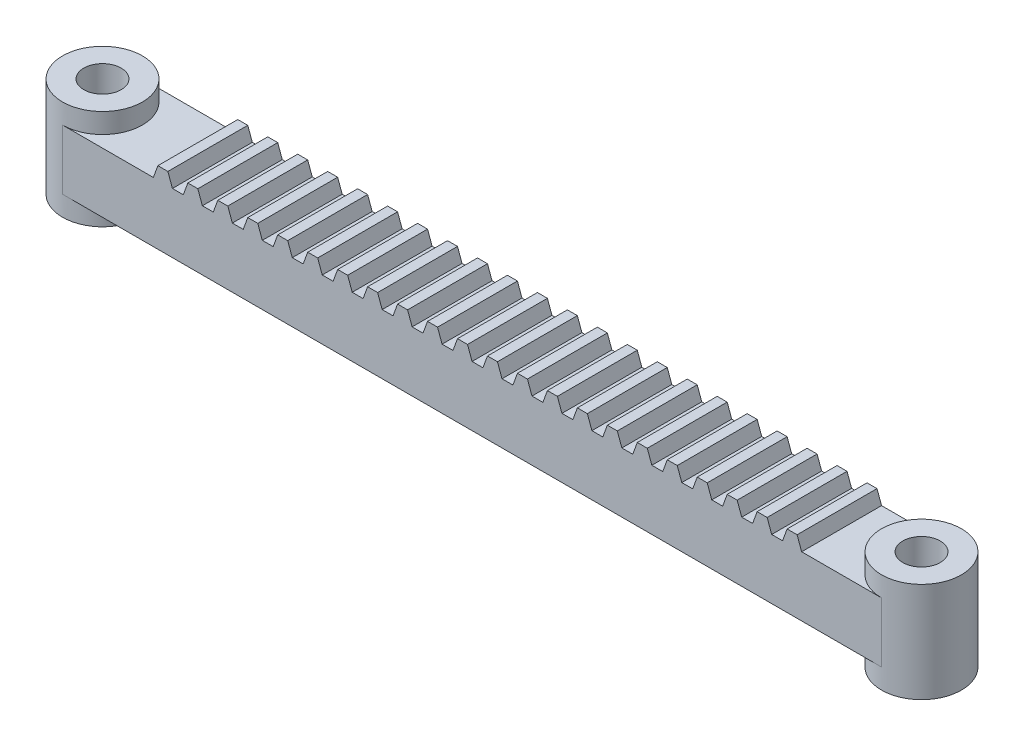
from build123d import *

# Parameters (mm, degrees)
BOSS_EXTRUDE1_DEPTH      = 8
BOSS_EXTRUDE1_DEPTH_BACK = 8
BOSS_EXTRUDE2_DEPTH      = 4
BOSS_EXTRUDE2_DEPTH_BACK = 16
SKETCH2_R                = 8
SKETCH2_R_2              = 3.75
SKETCH2_2_R              = 3.75
CUT_EXTRUDE1_DEPTH       = 16


with BuildPart() as part:
    # Sketch1 → Boss-Extrude1 (new, two sides: drawn at the far end of the back side and taken through both)
    with BuildSketch(Plane.XY.offset(-BOSS_EXTRUDE1_DEPTH_BACK)):
        Polygon((-82, 12), (-82, 0), (82, 0), (82, 12), (66, 12), (65.090074414, 14.5), (63.090074414, 14.5), (62.180148829, 12), (60, 12), (59.090074414, 14.5), (57.090074414, 14.5), (56.180148829, 12), (54, 12), (53.090074414, 14.5), (51.090074414, 14.5), (50.180148829, 12), (48, 12), (47.090074414, 14.5), (45.090074414, 14.5), (44.180148829, 12), (42, 12), (41.090074414, 14.5), (39.090074414, 14.5), (38.180148829, 12), (36, 12), (35.090074414, 14.5), (33.090074414, 14.5), (32.180148829, 12), (30, 12), (29.090074414, 14.5), (27.090074414, 14.5), (26.180148829, 12), (24, 12), (23.090074414, 14.5), (21.090074414, 14.5), (20.180148829, 12), (18, 12), (17.090074414, 14.5), (15.090074414, 14.5), (14.180148829, 12), (12, 12), (11.090074414, 14.5), (9.090074414, 14.5), (8.180148829, 12), (6, 12), (5.090074414, 14.5), (3.090074414, 14.5), (2.180148829, 12), (0, 12), (-0.909925586, 14.5), (-2.909925586, 14.5), (-3.819851171, 12), (-6, 12), (-6.909925586, 14.5), (-8.909925586, 14.5), (-9.819851171, 12), (-12, 12), (-12.909925586, 14.5), (-14.909925586, 14.5), (-15.819851171, 12), (-18, 12), (-18.909925586, 14.5), (-20.909925586, 14.5), (-21.819851171, 12), (-24, 12), (-24.909925586, 14.5), (-26.909925586, 14.5), (-27.819851171, 12), (-30, 12), (-30.909925586, 14.5), (-32.909925586, 14.5), (-33.819851171, 12), (-36, 12), (-36.909925586, 14.5), (-38.909925586, 14.5), (-39.819851171, 12), (-42, 12), (-42.909925586, 14.5), (-44.909925586, 14.5), (-45.819851171, 12), (-48, 12), (-48.909925586, 14.5), (-50.909925586, 14.5), (-51.819851171, 12), (-54, 12), (-54.909925586, 14.5), (-56.909925586, 14.5), (-57.819851171, 12), (-60, 12), (-60.909925586, 14.5), (-62.909925586, 14.5), (-63.819851171, 12), (-66, 12), align=None)
    extrude(amount=BOSS_EXTRUDE1_DEPTH + BOSS_EXTRUDE1_DEPTH_BACK)

    # Sketch2 → Boss-Extrude2 (add, two sides: drawn at the far end of the back side and taken through both)
    # profile 1 of 2: a face of its own
    with BuildSketch(Plane(origin=(0, 12, 0), x_dir=(1, 0, 0), z_dir=(0, 1, 0)).offset(-BOSS_EXTRUDE2_DEPTH_BACK)):
        with Locations((82, 0)):
            Circle(SKETCH2_R)
        with Locations((82, 0)):
            Circle(SKETCH2_R_2, mode=Mode.SUBTRACT)
    # profile 2 of 2: a face of its own
    with BuildSketch(Plane(origin=(0, 12, 0), x_dir=(1, 0, 0), z_dir=(0, 1, 0)).offset(-BOSS_EXTRUDE2_DEPTH_BACK)):
        with Locations((-82, 0)):
            Circle(SKETCH2_R)
        with Locations((-82, 0)):
            Circle(SKETCH2_R_2, mode=Mode.SUBTRACT)
    extrude(amount=BOSS_EXTRUDE2_DEPTH + BOSS_EXTRUDE2_DEPTH_BACK)

    # Sketch2<2> → Cut-Extrude1 (cut)
    with BuildSketch(Plane(origin=(0, 12, 0), x_dir=(1, 0, 0), z_dir=(0, 1, 0))):
        with Locations((82, 0)):
            Circle(SKETCH2_2_R)
        with Locations((-82, 0)):
            Circle(SKETCH2_2_R)
    extrude(amount=-CUT_EXTRUDE1_DEPTH, mode=Mode.SUBTRACT)


solid = part.part
